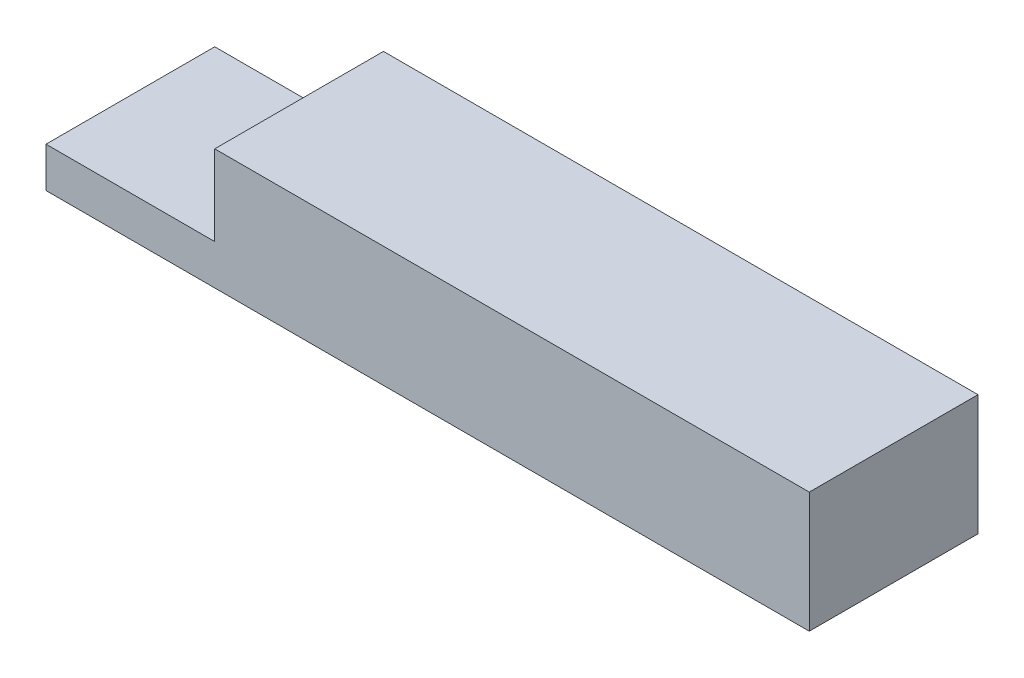
from build123d import *

# Parameters (mm, degrees)
SKETCH1_W           = 95
SKETCH1_H           = 21
BOSS_EXTRUDE2_DEPTH = 15
SKETCH3_W           = 21
SKETCH3_H           = 21
CUT_EXTRUDE1_DEPTH  = 10


with BuildPart() as part:
    # Sketch1 → Boss-Extrude2 (new body)
    with BuildSketch(Plane(origin=(0, 0, 0), x_dir=(1, 0, 0), z_dir=(0, 1, 0))):
        with Locations((47.5, 10.5)):
            Rectangle(SKETCH1_W, SKETCH1_H)
    extrude(amount=BOSS_EXTRUDE2_DEPTH)

    # Sketch3 → Cut-Extrude1 (cut)
    with BuildSketch(Plane(origin=(0, 15, 0), x_dir=(1, 0, 0), z_dir=(0, 1, 0))):
        with Locations((10.5, 10.5)):
            Rectangle(SKETCH3_W, SKETCH3_H)
    extrude(amount=-CUT_EXTRUDE1_DEPTH, mode=Mode.SUBTRACT)


solid = part.part
